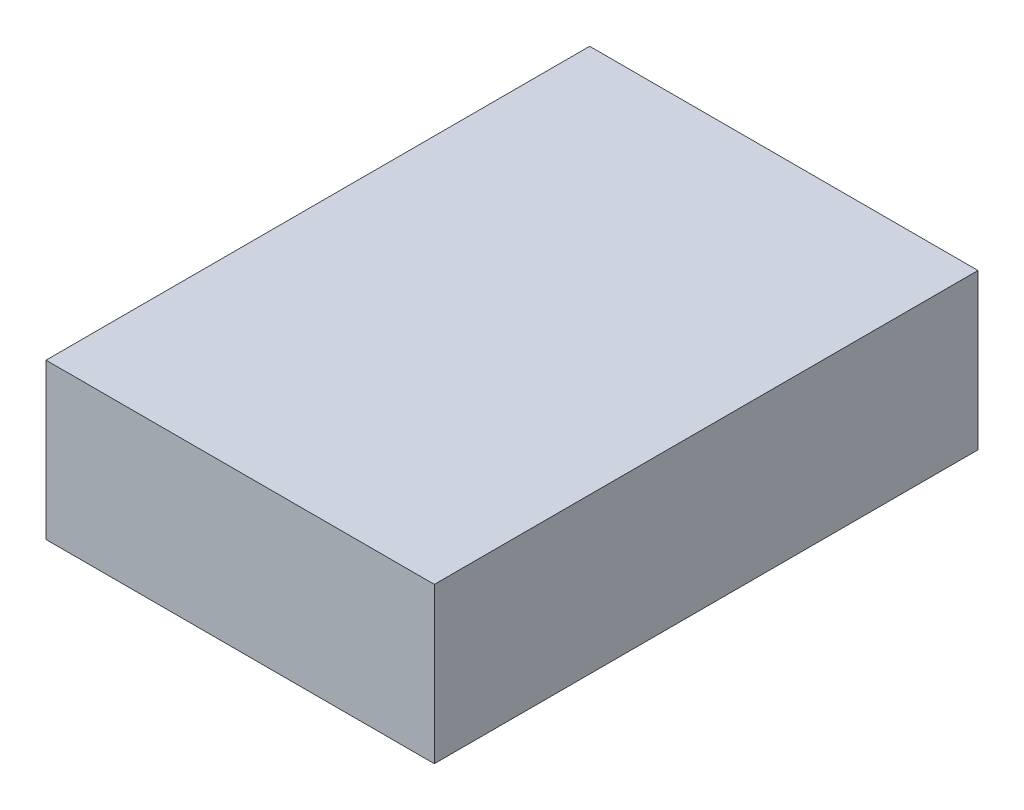
from build123d import *

# Parameters (mm, degrees)
SKETCH1_W           = 25
SKETCH1_H           = 10
BOSS_EXTRUDE1_DEPTH = 35


with BuildPart() as part:
    # Sketch1 → Boss-Extrude1 (new body)
    with BuildSketch(Plane.XY):
        Rectangle(SKETCH1_W, SKETCH1_H)
    extrude(amount=BOSS_EXTRUDE1_DEPTH)


solid = part.part
